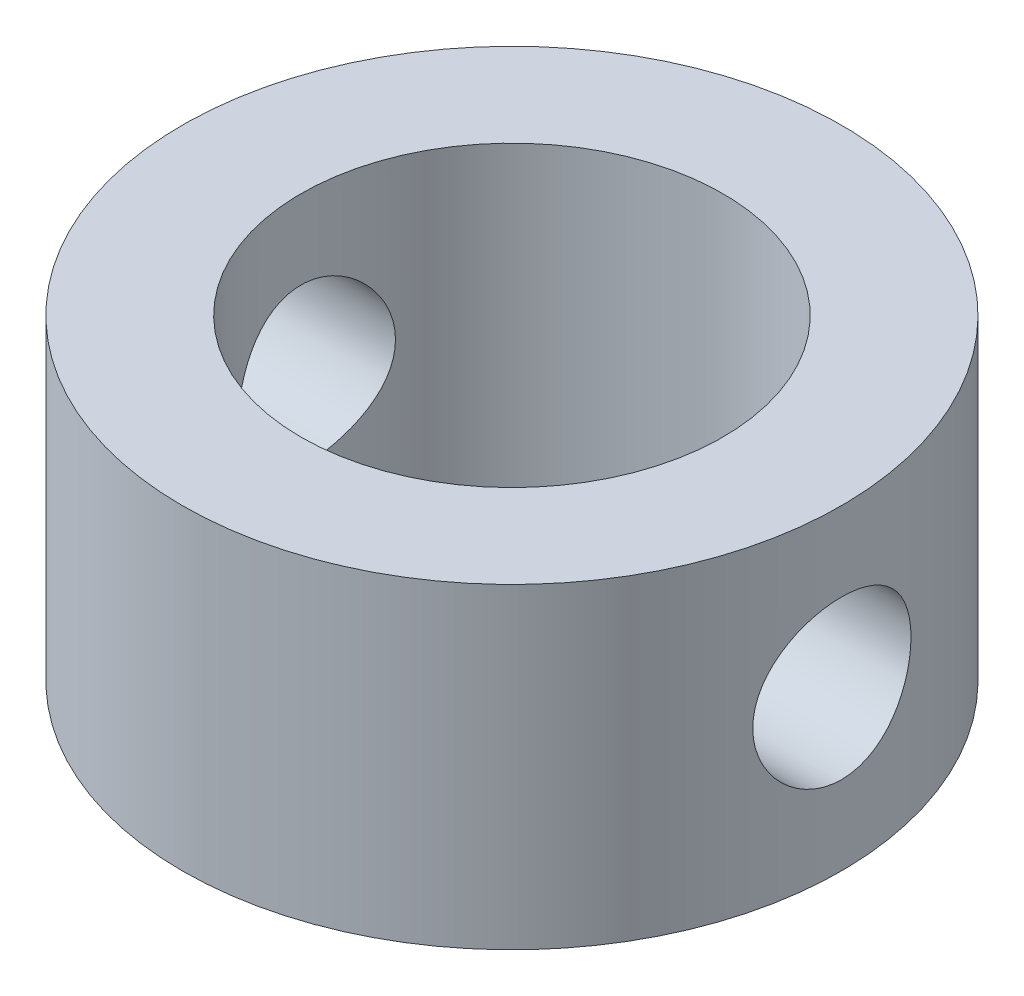
from build123d import *

# Parameters (mm, degrees)
SKETCH1_R           = 12.5
SKETCH1_R_2         = 8
BOSS_EXTRUDE1_DEPTH = 12
SKETCH2_R           = 3
CUT_EXTRUDE1_DEPTH  = 24


with BuildPart() as part:
    # Sketch1 → Boss-Extrude1 (new body)
    with BuildSketch(Plane(origin=(0, 0, 0), x_dir=(1, 0, 0), z_dir=(0, 1, 0))):
        with Locations(Location((0, 0, 0), (0, 0, 270))):
            Circle(SKETCH1_R)
        with Locations(Location((0, 0, 0), (0, 0, 270))):
            Circle(SKETCH1_R_2, mode=Mode.SUBTRACT)
    extrude(amount=BOSS_EXTRUDE1_DEPTH)

    # Sketch2 → Cut-Extrude1 (cut, symmetric)
    with BuildSketch(Plane(origin=(0, 0, 0), x_dir=(0, 0, -1), z_dir=(1, 0, 0))):
        with Locations((0, 6)):
            Circle(SKETCH2_R)
    extrude(amount=CUT_EXTRUDE1_DEPTH, both=True, mode=Mode.SUBTRACT)


solid = part.part
